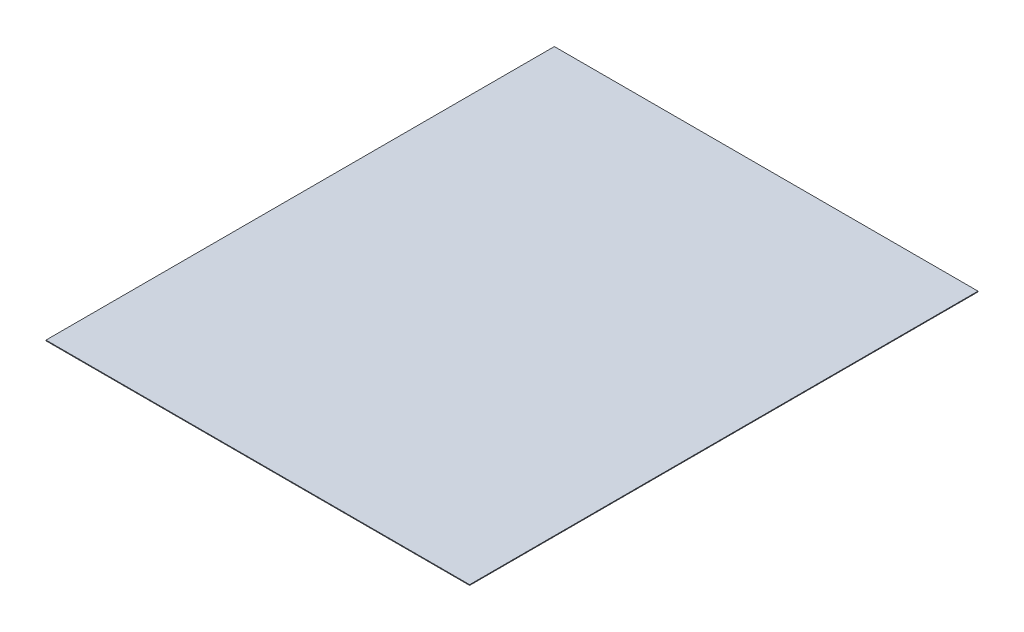
from build123d import *

# Parameters (mm, degrees)
ESQUISSE1_W        = 6000
ESQUISSE1_H        = 7200
BOSS_EXTRU_1_DEPTH = 10


with BuildPart() as part:
    # Esquisse1 → Boss.-Extru.1 (new body)
    with BuildSketch(Plane(origin=(0, 0, 0), x_dir=(1, 0, 0), z_dir=(0, 1, 0))):
        Rectangle(ESQUISSE1_W, ESQUISSE1_H)
    extrude(amount=BOSS_EXTRU_1_DEPTH)


solid = part.part
